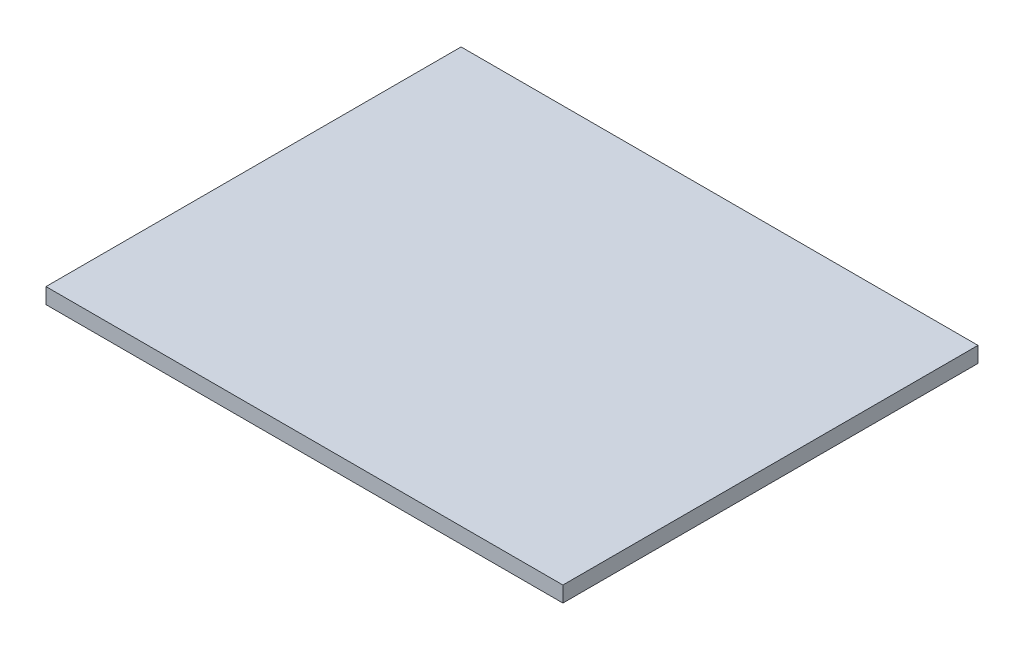
from build123d import *

# Parameters (mm, degrees)
SKETCH1_W     = 66
SKETCH1_H     = 2
PROFILE_DEPTH = 53


with BuildPart() as part:
    # Sketch1 → Profile (new body)
    with BuildSketch(Plane.XY):
        with Locations((33, 1)):
            Rectangle(SKETCH1_W, SKETCH1_H)
    extrude(amount=PROFILE_DEPTH)


solid = part.part
